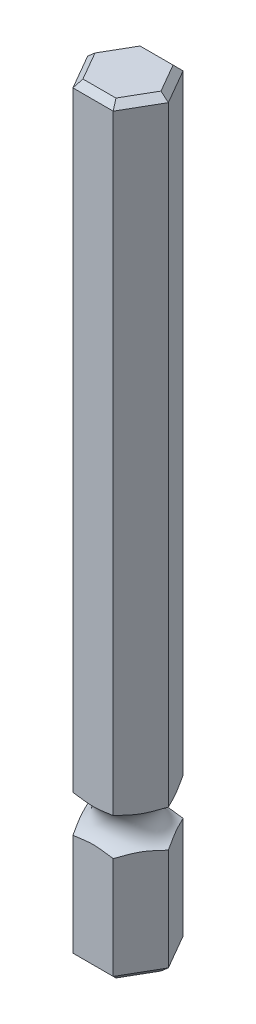
from build123d import *

# Parameters (mm, degrees)
CUT_EXTRUDE1_DEPTH      = 31.656361493
CUT_EXTRUDE1_DEPTH_BACK = 31.656361493
SKETCH5_R               = 4
CHAMFER1_SIZE           = 0.5


with BuildPart() as part:
    # Sketch2 → Revolve1 (revolve)
    with BuildSketch(Plane.XY, mode=Mode.PRIVATE) as revolve1_sk:
        with BuildLine():
            Line((-1.75, -18.5), (-1.75, 30))
            Line((-1.75, 30), (1.75, 30))
            Line((1.75, 30), (1.75, -30))
            Line((1.75, -30), (-1.75, -30))
            Line((-1.75, -30), (-1.75, -21.5))
            ThreePointArc((-1.75, -21.5), (-0.25, -20), (-1.75, -18.5))
        make_face()
    revolve(revolve1_sk.sketch.rotate(Axis((1.75, -30, 0), (0, 1, 0)), 270), axis=Axis((1.75, -30, 0), (0, 1, 0)))

    # Sketch5 → Cut-Extrude1 (cut, two sides: drawn at the far end of the back side and taken through both)
    with BuildSketch(Plane(origin=(0, 0, 0), x_dir=(1, 0, 0), z_dir=(0, 1, 0)).offset(-CUT_EXTRUDE1_DEPTH_BACK)):
        with Locations((1.75, 0)):
            Circle(SKETCH5_R)
        Polygon((4.925, 0), (3.3375, 2.749630657), (0.1625, 2.749630657), (-1.425, 0), (0.1625, -2.749630657), (3.3375, -2.749630657), align=None, mode=Mode.SUBTRACT)
    extrude(amount=CUT_EXTRUDE1_DEPTH + CUT_EXTRUDE1_DEPTH_BACK, mode=Mode.SUBTRACT)

    # Chamfer1
    chamfer1_edges = [part.edges().sort_by_distance(p)[0] for p in [
        (1.75, -30, 2.749630657),
        (4.13125, -30, 1.374815329),
        (4.13125, -30, -1.374815329),
        (1.75, -30, -2.749630657),
        (-0.63125, -30, -1.374815329),
        (-0.63125, -30, 1.374815329),
        (4.13125, 30, 1.374815329),
        (1.75, 30, 2.749630657),
        (-0.63125, 30, 1.374815329),
        (-0.63125, 30, -1.374815329),
        (1.75, 30, -2.749630657),
        (4.13125, 30, -1.374815329),
    ]]
    chamfer(chamfer1_edges, length=CHAMFER1_SIZE)


solid = part.part
